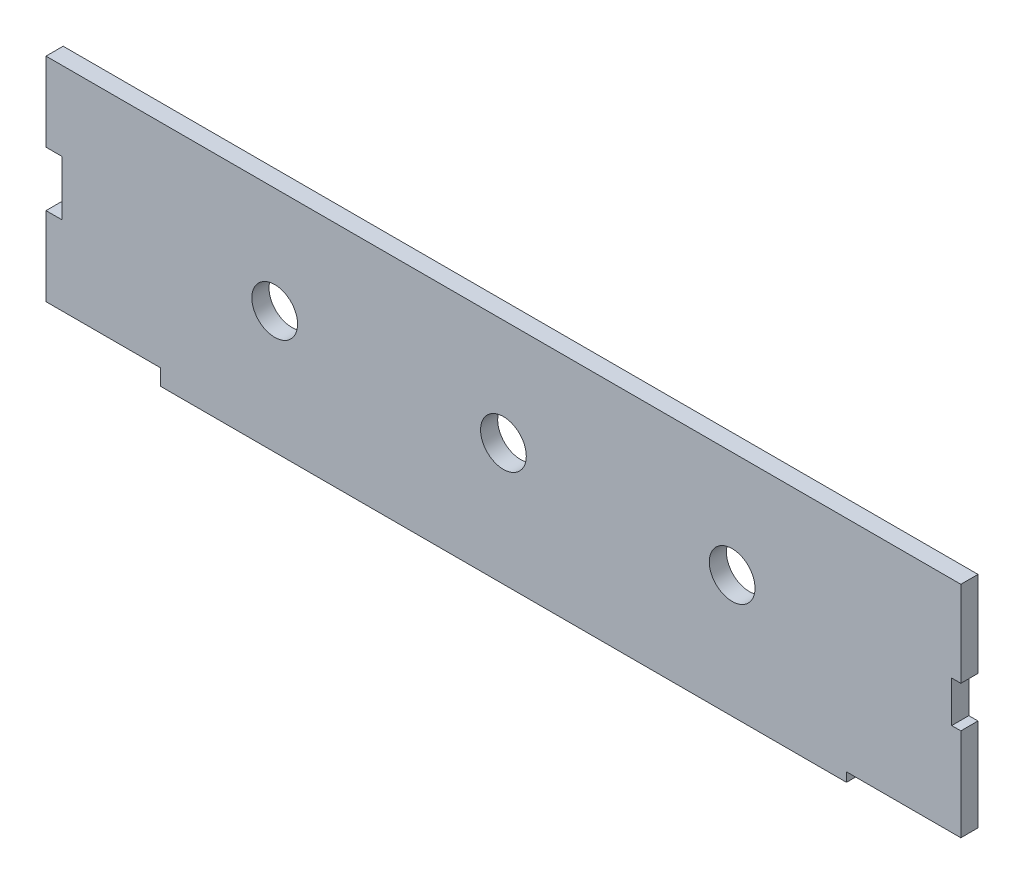
from build123d import *

# Parameters (mm, degrees)
CROQUIS1_R              = 2
SALIENTE_EXTRUIR1_DEPTH = 1.5


with BuildPart() as part:
    # Croquis1 → Saliente-Extruir1 (new body)
    with BuildSketch(Plane.XY):
        Polygon((-40, 9.3), (40, 9.3), (40, 1.8), (39.2, 1.8), (39.2, -1.8), (40, -1.8), (40, -9.9), (30, -9.9), (30, -10.7), (-30, -10.7), (-30, -9.3), (-40, -9.3), (-40, -2.4), (-38.6, -2.4), (-38.6, 2.4), (-40, 2.4), align=None)
        with Locations((20, 0)):
            Circle(CROQUIS1_R, mode=Mode.SUBTRACT)
        Circle(CROQUIS1_R, mode=Mode.SUBTRACT)
        with Locations((-20, 0)):
            Circle(CROQUIS1_R, mode=Mode.SUBTRACT)
    extrude(amount=SALIENTE_EXTRUIR1_DEPTH)


solid = part.part
